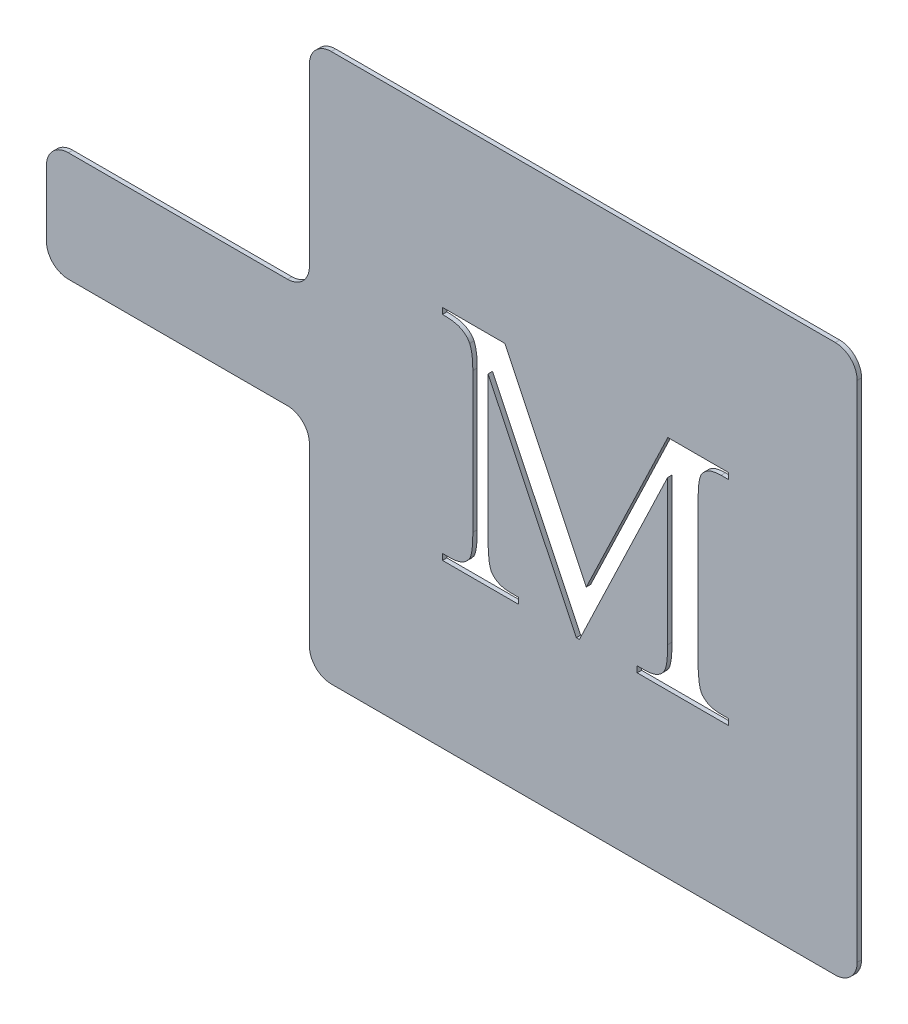
from build123d import *

# Parameters (mm, degrees)
BOSS_EXTRUDE1_DEPTH = 2
CUT_EXTRUDE1_DEPTH  = 2


with BuildPart() as part:
    # Sketch1 → Boss-Extrude1 (new body)
    with BuildSketch(Plane.XY):
        with BuildLine():
            Line((10, 0), (240, 0))
            ThreePointArc((240, 0), (247.071067812, 2.928932188), (250, 10))
            Line((250, 10), (250, 240))
            ThreePointArc((250, 240), (247.071067812, 247.071067812), (240, 250))
            Line((240, 250), (10, 250))
            ThreePointArc((10, 250), (2.928932188, 247.071067812), (0, 240))
            Line((0, 240), (0, 160))
            ThreePointArc((0, 160), (-2.928932188, 152.928932188), (-10, 150))
            Line((-10, 150), (-110, 150))
            ThreePointArc((-110, 150), (-117.071067812, 147.071067812), (-120, 140))
            Line((-120, 140), (-120, 110))
            ThreePointArc((-120, 110), (-117.071067812, 102.928932188), (-110, 100))
            Line((-110, 100), (-10, 100))
            ThreePointArc((-10, 100), (-2.928932188, 97.071067812), (0, 90))
            Line((0, 90), (0, 10))
            ThreePointArc((0, 10), (2.928932188, 2.928932188), (10, 0))
        make_face()
    extrude(amount=BOSS_EXTRUDE1_DEPTH)

    # Sketch2 → Cut-Extrude1 (cut)
    with BuildSketch(Plane.XY.offset(2)):
        with BuildLine():
            Line((121.831245853, 74.238883319), (81.553468075, 158.375168042))
            Line((81.553468075, 158.375168042), (81.553468075, 92.294438875))
            add(Edge.make_bspline(
                [(81.553468075, 92.294438875), (81.552441695, 91.527408259), (81.550494213, 90.07202371), (81.67476659, 88.003330285), (81.809557178, 86.154926562), (82.033410561, 84.535090304), (82.270961447, 83.126350994), (82.624899995, 81.963045824), (82.992758599, 80.996359886), (83.345604613, 80.48395593), (83.506593075, 80.250168042)],
                knots=[0, 0, 0, 0, 1.48973486, 2.826663046, 4.025252461, 5.088590954, 6.003687083, 6.795186099, 7.45029523, 8, 8, 8, 8], degree=3))
            add(Edge.make_bspline(
                [(83.506593075, 80.250168042), (83.997407371, 79.750770196), (84.996905643, 78.733792313), (87.003759394, 77.711270113), (89.366130367, 77.105906039), (91.068976257, 77.047545775), (91.970134742, 77.016661097)],
                knots=[0, 0, 0, 0, 0.893460505, 1.819450328, 2.846037184, 4, 4, 4, 4], degree=3))
            Line((91.970134742, 77.016661097), (95.442356964, 77.016661097))
            Line((95.442356964, 77.016661097), (95.442356964, 74.238883319))
            Line((95.442356964, 74.238883319), (60.720134742, 74.238883319))
            Line((60.720134742, 74.238883319), (60.720134742, 77.016661097))
            Line((60.720134742, 77.016661097), (64.192356964, 77.016661097))
            add(Edge.make_bspline(
                [(64.192356964, 77.016661097), (64.692336968, 77.027575423), (65.660187495, 77.048703141), (67.053155801, 77.255679207), (68.340072371, 77.542980734), (69.511077493, 77.990029314), (70.577284489, 78.54537262), (71.523997685, 79.246760067), (72.334604766, 80.088398233), (72.793088669, 80.714808629), (73.024822242, 81.031418042)],
                knots=[0, 0, 0, 0, 1.182386838, 2.288838982, 3.326958154, 4.296765023, 5.246416275, 6.164047556, 7.072046332, 8, 8, 8, 8], degree=3))
            add(Edge.make_bspline(
                [(73.024822242, 81.031418042), (73.154175481, 81.267158908), (73.438935547, 81.786122213), (73.754068555, 82.7087764), (73.999815936, 83.832477906), (74.243351558, 85.140425739), (74.413930293, 86.655788373), (74.502709761, 88.358707772), (74.607417007, 90.260571867), (74.608469203, 91.592574666), (74.609023631, 92.294438875)],
                knots=[0, 0, 0, 0, 0.561580455, 1.236271222, 2.028879402, 2.966584022, 4.017422664, 5.2149421, 6.532486222, 8, 8, 8, 8], degree=3))
            Line((74.609023631, 92.294438875), (74.609023631, 156.183327764))
            add(Edge.make_bspline(
                [(74.609023631, 156.183327764), (74.598097419, 157.262279808), (74.57781297, 159.265348068), (74.292147678, 162.020464101), (73.887395445, 164.316152629), (73.38248359, 165.621386735), (73.155030575, 166.20936943)],
                knots=[0, 0, 0, 0, 1.269100049, 2.356076937, 3.259444487, 4, 4, 4, 4], degree=3))
            add(Edge.make_bspline(
                [(73.155030575, 166.20936943), (72.964440038, 166.571330676), (72.572351095, 167.315968917), (71.739346077, 168.310495354), (70.678433406, 169.192456789), (69.404596857, 170.014029453), (67.793926343, 170.70426646), (65.790057774, 171.151821363), (63.389943364, 171.426827209), (61.654210729, 171.449112709), (60.720134742, 171.461105542)],
                knots=[0, 0, 0, 0, 0.685675889, 1.410594349, 2.160436148, 2.996293973, 3.94870651, 5.086176952, 6.431940446, 8, 8, 8, 8], degree=3))
            Line((60.720134742, 171.461105542), (60.720134742, 174.238883319))
            Line((60.720134742, 174.238883319), (89.192356964, 174.238883319))
            Line((89.192356964, 174.238883319), (126.38853752, 96.547911097))
            Line((126.38853752, 96.547911097), (163.584718075, 174.238883319))
            Line((163.584718075, 174.238883319), (191.275690297, 174.238883319))
            Line((191.275690297, 174.238883319), (191.275690297, 171.461105542))
            Line((191.275690297, 171.461105542), (187.868572242, 171.461105542))
            add(Edge.make_bspline(
                [(187.868572242, 171.461105542), (187.361287545, 171.450707073), (186.386065744, 171.430716694), (184.979607429, 171.218940655), (183.683652592, 170.938748781), (182.506844601, 170.48708074), (181.439074078, 169.933617837), (180.493564629, 169.223853404), (179.660586682, 168.397082941), (179.201520738, 167.764165368), (178.971002797, 167.446348597)],
                knots=[0, 0, 0, 0, 1.192663738, 2.292818382, 3.341598875, 4.305885976, 5.250132179, 6.162540657, 7.077327887, 8, 8, 8, 8], degree=3))
            add(Edge.make_bspline(
                [(178.971002797, 167.446348597), (178.841649558, 167.210607731), (178.556889492, 166.691644426), (178.241756484, 165.768990238), (177.996009103, 164.645288733), (177.752473481, 163.3373409), (177.581894746, 161.821978266), (177.493115279, 160.119058867), (177.388408032, 158.217194771), (177.387355836, 156.885191972), (177.386801408, 156.183327764)],
                knots=[0, 0, 0, 0, 0.561580455, 1.236271222, 2.028879402, 2.966584022, 4.017422664, 5.2149421, 6.532486222, 8, 8, 8, 8], degree=3))
            Line((177.386801408, 156.183327764), (177.386801408, 92.294438875))
            add(Edge.make_bspline(
                [(177.386801408, 92.294438875), (177.385877428, 91.527429602), (177.384124243, 90.072085551), (177.507098339, 88.003121526), (177.646069278, 86.155589108), (177.85710522, 84.531668283), (178.13424254, 83.12975452), (178.473014721, 81.957654643), (178.8699969, 80.994203331), (179.237061444, 80.483751398), (179.405030575, 80.250168042)],
                knots=[0, 0, 0, 0, 1.486776415, 2.821049613, 4.017258766, 5.078485589, 5.994452933, 6.784380121, 7.443731031, 8, 8, 8, 8], degree=3))
            add(Edge.make_bspline(
                [(179.405030575, 80.250168042), (179.895423699, 79.749880201), (180.898563608, 78.726499826), (182.913754693, 77.721375862), (185.270314869, 77.101877529), (186.966975459, 77.046231247), (187.868572242, 77.016661097)],
                knots=[0, 0, 0, 0, 0.893634595, 1.828003868, 2.845812335, 4, 4, 4, 4], degree=3))
            Line((187.868572242, 77.016661097), (191.275690297, 77.016661097))
            Line((191.275690297, 77.016661097), (191.275690297, 74.238883319))
            Line((191.275690297, 74.238883319), (149.609023631, 74.238883319))
            Line((149.609023631, 74.238883319), (149.609023631, 77.016661097))
            Line((149.609023631, 77.016661097), (153.081245853, 77.016661097))
            add(Edge.make_bspline(
                [(153.081245853, 77.016661097), (153.588433734, 77.027378344), (154.563469412, 77.047981553), (155.964240322, 77.254470656), (157.255601407, 77.548600741), (158.43409031, 77.978736677), (159.491525168, 78.55248399), (160.434038314, 79.246610187), (161.24579725, 80.082629427), (161.690291414, 80.714044665), (161.913711131, 81.031418042)],
                knots=[0, 0, 0, 0, 1.198333024, 2.303717216, 3.340834392, 4.325725627, 5.259386468, 6.176132048, 7.08325442, 8, 8, 8, 8], degree=3))
            add(Edge.make_bspline(
                [(161.913711131, 81.031418042), (162.04306437, 81.267158908), (162.327824436, 81.786122213), (162.642957444, 82.7087764), (162.888704825, 83.832477906), (163.132240447, 85.140425739), (163.302819182, 86.655788373), (163.391598649, 88.358707772), (163.496305896, 90.260571867), (163.497358092, 91.592574666), (163.49791252, 92.294438875)],
                knots=[0, 0, 0, 0, 0.561580455, 1.236271222, 2.028879402, 2.966584022, 4.017422664, 5.2149421, 6.532486222, 8, 8, 8, 8], degree=3))
            Line((163.49791252, 92.294438875), (163.49791252, 158.375168042))
            Line((163.49791252, 158.375168042), (123.220134742, 74.238883319))
            Line((123.220134742, 74.238883319), (121.831245853, 74.238883319))
        make_face()
    extrude(amount=-CUT_EXTRUDE1_DEPTH, mode=Mode.SUBTRACT)


solid = part.part
